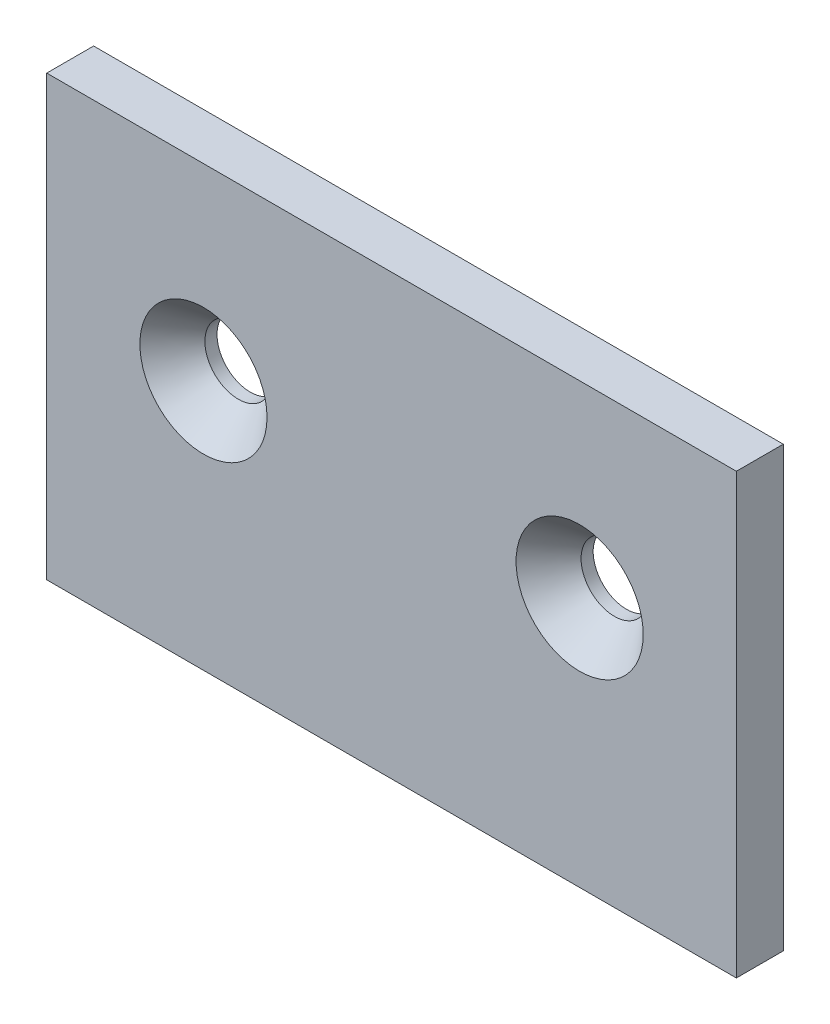
from build123d import *

# Parameters (mm, degrees)
SKETCH1_W                                     = 69.85
SKETCH1_H                                     = 44.45
BOSS_EXTRUDE1_DEPTH                           = 4.7498
CSK_FOR_1_4_FLAT_HEAD_MACHINE_SCREW1_AT_COUNT = 2
CSK_FOR_1_4_FLAT_HEAD_MACHINE_SCREW1_AT_PITCH = 38.1


with BuildPart() as part:
    # Sketch1 → Boss-Extrude1 (new body)
    with BuildSketch(Plane.XY):
        with Locations((0, 22.225)):
            Rectangle(SKETCH1_W, SKETCH1_H)
    extrude(amount=BOSS_EXTRUDE1_DEPTH)

    # Sketch3 → CSK for 1/4 Flat Head Machine Screw1 (revolve, cut)
    with BuildSketch(Plane(origin=(19.05, 25.4, 4.7498), x_dir=(0, -1, 0), z_dir=(1, 0, 0))):
        Polygon((0, 0), (0, 4.7498), (3.3782, 4.7498), (3.3782, 3.520932584), (6.4389, 0), align=None)
    csk_for_1_4_flat_head_machine_screw1 = revolve(axis=Axis((19.05, 25.4, 11.0998), (0, 0, -1)), mode=Mode.SUBTRACT)

    # CSK for 1/4 Flat Head Machine Screw1 at: CSK for 1/4 Flat Head Machine Screw1 ×2
    with Locations(*[(-i * CSK_FOR_1_4_FLAT_HEAD_MACHINE_SCREW1_AT_PITCH, 0, 0) for i in range(1, CSK_FOR_1_4_FLAT_HEAD_MACHINE_SCREW1_AT_COUNT)]):
        add(csk_for_1_4_flat_head_machine_screw1, mode=Mode.SUBTRACT)


solid = part.part
